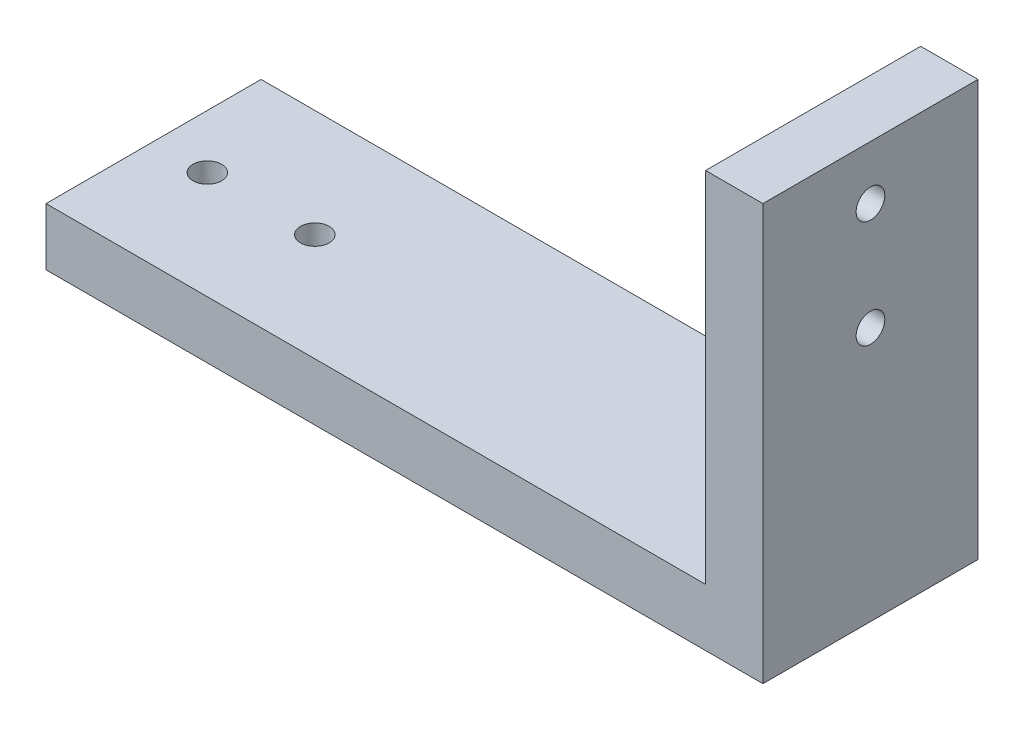
from build123d import *

# Parameters (mm, degrees)
SKETCH1_W           = 100
SKETCH1_H           = 30
SKETCH1_R           = 2
BOSS_EXTRUDE1_DEPTH = 8
SKETCH2_W           = 8
SKETCH2_H           = 30
BOSS_EXTRUDE2_DEPTH = 50
SKETCH3_R           = 2
CUT_EXTRUDE1_DEPTH  = 50


with BuildPart() as part:
    # Sketch1 → Boss-Extrude1 (new body)
    with BuildSketch(Plane(origin=(0, 0, 0), x_dir=(1, 0, 0), z_dir=(0, 1, 0))):
        Rectangle(SKETCH1_W, SKETCH1_H)
        with Locations(Location((-42.5, 0, 0), (0, 0, 270))):
            Circle(SKETCH1_R, mode=Mode.SUBTRACT)
        with Locations(Location((-27.5, 0, 0), (0, 0, 270))):
            Circle(SKETCH1_R, mode=Mode.SUBTRACT)
    extrude(amount=BOSS_EXTRUDE1_DEPTH)

    # Sketch2 → Boss-Extrude2 (add)
    with BuildSketch(Plane(origin=(0, 8, 0), x_dir=(1, 0, 0), z_dir=(0, 1, 0))):
        with Locations((46, 0)):
            Rectangle(SKETCH2_W, SKETCH2_H)
    extrude(amount=BOSS_EXTRUDE2_DEPTH)

    # Sketch3 → Cut-Extrude1 (cut)
    with BuildSketch(Plane(origin=(50, 0, 0), x_dir=(0, 0, -1), z_dir=(1, 0, 0))):
        with Locations((0, 50.5)):
            Circle(SKETCH3_R)
        with Locations((0, 35.5)):
            Circle(SKETCH3_R)
    extrude(amount=-CUT_EXTRUDE1_DEPTH, mode=Mode.SUBTRACT)


solid = part.part
